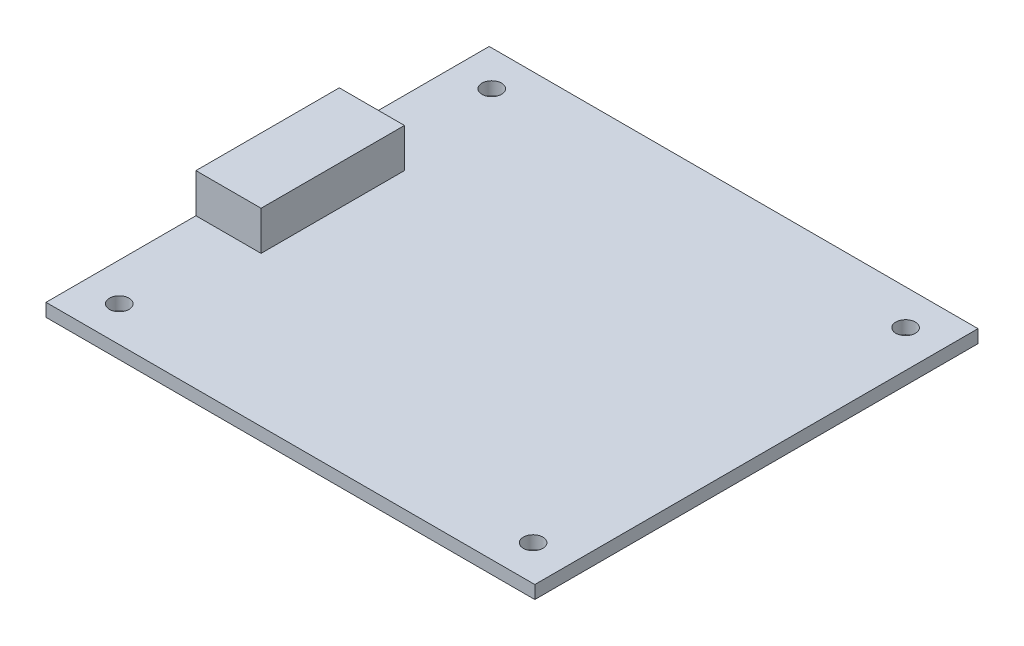
from build123d import *

# Parameters (mm, degrees)
SKETCH1_W           = 75
SKETCH1_H           = 68
SKETCH1_R           = 1.5
BOSS_EXTRUDE1_DEPTH = 2
SKETCH2_R           = 3
BOSS_EXTRUDE2_DEPTH = 10
SKETCH3_R           = 2
BOSS_EXTRUDE3_DEPTH = 8
FILLET1_R           = 0.3
SKETCH4_W           = 10
SKETCH4_H           = 22
BOSS_EXTRUDE4_DEPTH = 6


with BuildPart() as part:
    # Sketch1 → Boss-Extrude1 (new body)
    with BuildSketch(Plane(origin=(0, 0, 0), x_dir=(1, 0, 0), z_dir=(0, 1, 0))):
        Rectangle(SKETCH1_W, SKETCH1_H)
        with Locations(Location((31.8135, 28.575, 0), (0, 0, 270))):
            Circle(SKETCH1_R, mode=Mode.SUBTRACT)
        with Locations(Location((31.8135, -28.575, 0), (0, 0, 270))):
            Circle(SKETCH1_R, mode=Mode.SUBTRACT)
        with Locations(Location((-31.6865, 28.575, 0), (0, 0, 270))):
            Circle(SKETCH1_R, mode=Mode.SUBTRACT)
        with Locations(Location((-31.6865, -28.575, 0), (0, 0, 270))):
            Circle(SKETCH1_R, mode=Mode.SUBTRACT)
    extrude(amount=BOSS_EXTRUDE1_DEPTH)

    # Sketch2 → Boss-Extrude2 (add)
    with BuildSketch(Plane.XZ):
        with Locations(Location((-21.592923404, 0, 0), (0, 0, 270))):
            Circle(SKETCH2_R)
    extrude(amount=BOSS_EXTRUDE2_DEPTH)

    # Sketch3 → Boss-Extrude3 (add)
    with BuildSketch(Plane.XZ):
        with Locations(Location((-21.743922868, -7.927471879, 0), (0, 0, 270))):
            Circle(SKETCH3_R)
    extrude(amount=BOSS_EXTRUDE3_DEPTH)

    # Fillet1
    fillet1_edges = [part.edges().sort_by_distance(p)[0] for p in [
        (-21.592923404, -10, 3),
        (-21.743922868, -8, -5.927471879),
    ]]
    fillet(fillet1_edges, radius=FILLET1_R)

    # Sketch4 → Boss-Extrude4 (add)
    with BuildSketch(Plane(origin=(0, 2, 0), x_dir=(1, 0, 0), z_dir=(0, 1, 0))):
        with Locations((-32.5, 0)):
            Rectangle(SKETCH4_W, SKETCH4_H)
    extrude(amount=BOSS_EXTRUDE4_DEPTH)


solid = part.part
